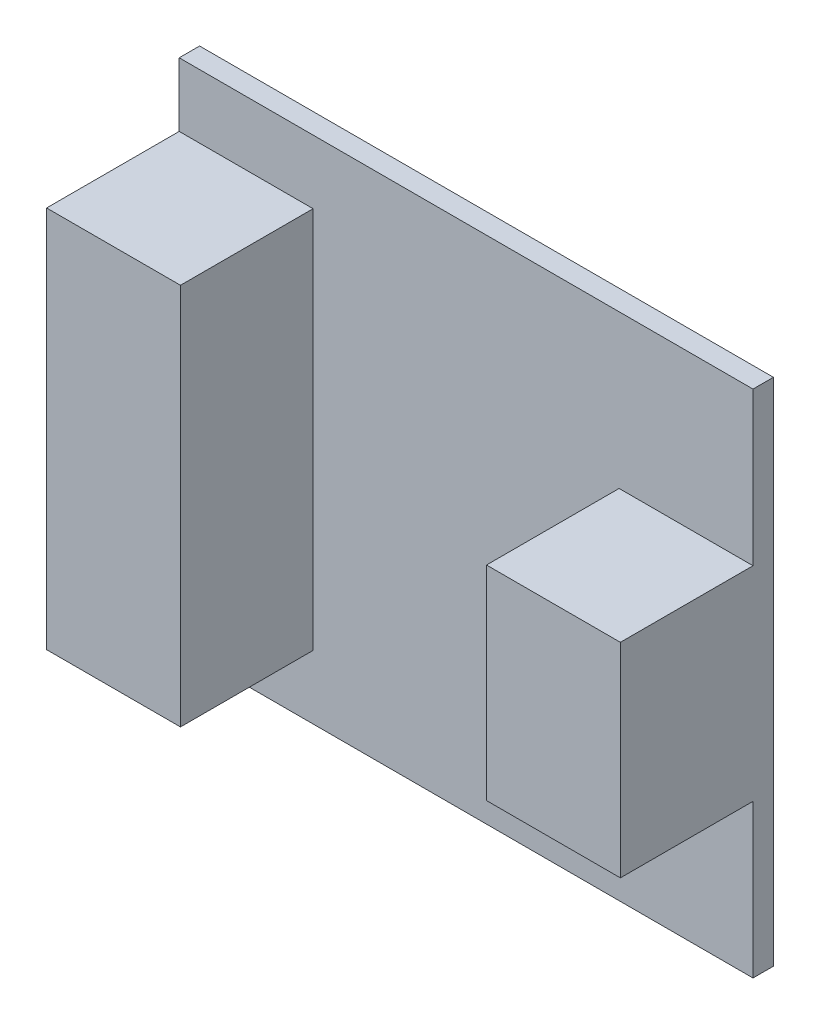
from build123d import *

# Parameters (mm, degrees)
SKETCH1_W             = 45
SKETCH1_H             = 40
PCB_DEPTH             = 1.6
SKETCH2_W             = 10.5
SKETCH2_H             = 30
MOTOR_TERMINALS_DEPTH = 10.4
SKETCH3_W             = 10.5
SKETCH3_H             = 16
POWER_TERMINAL_DEPTH  = 10.4


with BuildPart() as part:
    # Sketch1 → PCB (new body)
    with BuildSketch(Plane.XY):
        Rectangle(SKETCH1_W, SKETCH1_H)
    extrude(amount=PCB_DEPTH)

    # Sketch2 → Motor_terminals (add)
    with BuildSketch(Plane.XY.offset(1.6)):
        with Locations((-17.25, 0)):
            Rectangle(SKETCH2_W, SKETCH2_H)
    extrude(amount=MOTOR_TERMINALS_DEPTH)

    # Sketch3 → Power_terminal (add)
    with BuildSketch(Plane.XY.offset(1.6)):
        with Locations((17.25, 0)):
            Rectangle(SKETCH3_W, SKETCH3_H)
    extrude(amount=POWER_TERMINAL_DEPTH)


solid = part.part
